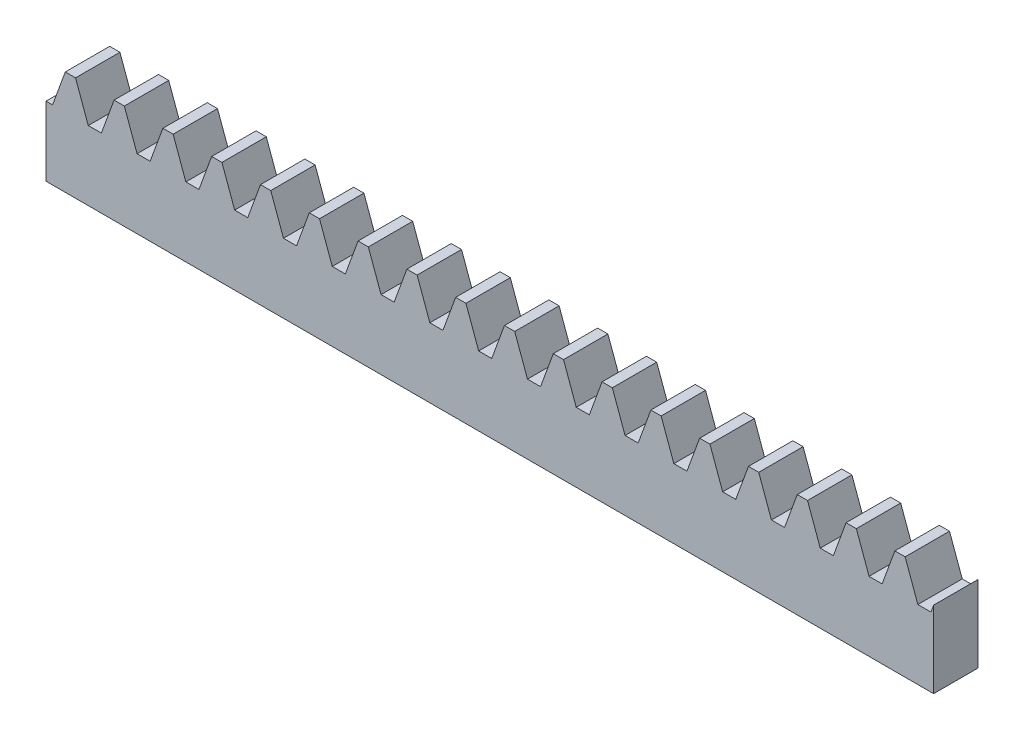
from build123d import *

# Parameters (mm, degrees)
BLANKSKE_W        = 100
BLANKSKE_H        = 11.75
BLANK_DEPTH       = 5
TOOTHCUTSIM_DEPTH = 101.812015653
TEETHCUTS_COUNT   = 20
TEETHCUTS_PITCH   = 5.497787138


with BuildPart() as part:
    # BlankSke → Blank (new body)
    with BuildSketch(Plane.XY):
        with Locations((50, 5.875)):
            Rectangle(BLANKSKE_W, BLANKSKE_H)
    extrude(amount=-BLANK_DEPTH)

    # TooCutSkeSim → ToothCutSim (cut, through all)
    with BuildSketch(Plane.XY):
        Polygon((0.737261897, 7.8125), (-0.737261897, 7.8125), (-2.179639538, 11.7754), (2.179639538, 11.7754), align=None)
    toothcutsim = extrude(amount=-TOOTHCUTSIM_DEPTH, mode=Mode.SUBTRACT)

    # TeethCuts: ToothCutSim ×20
    with Locations(*[(i * TEETHCUTS_PITCH, 0, 0) for i in range(1, TEETHCUTS_COUNT)]):
        add(toothcutsim, mode=Mode.SUBTRACT)


solid = part.part
